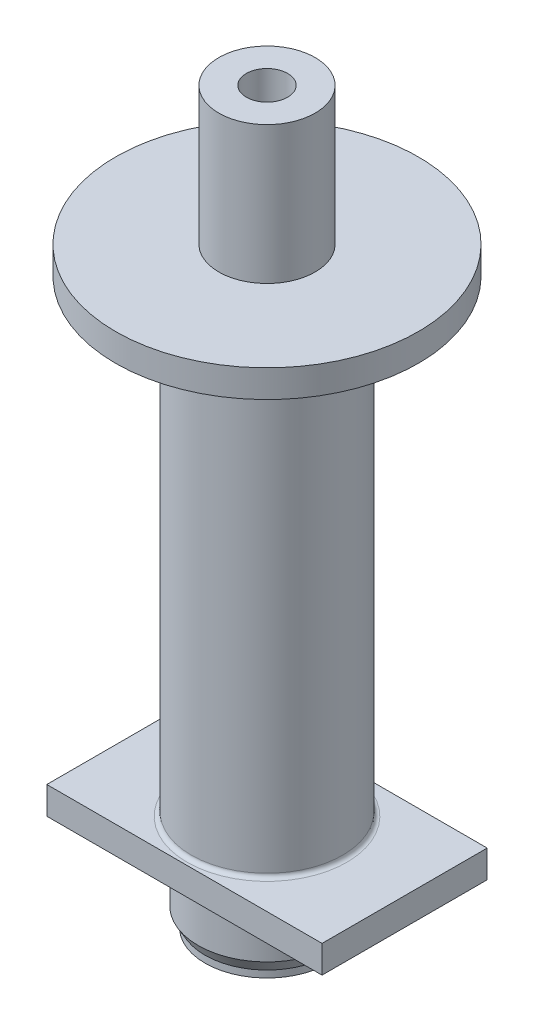
from build123d import *

# Parameters (mm, degrees)
FILLET1_R           = 3
SKETCH3_R           = 25
CUT_EXTRUDE2_DEPTH  = 410
SKETCH4_R           = 15
CUT_EXTRUDE3_DEPTH  = 150
BOSS_EXTRUDE1_DEPTH = 20


with BuildPart() as part:
    # Sketch1 → Revolve1 (revolve)
    with BuildSketch(Plane.XY, mode=Mode.PRIVATE) as revolve1_sk:
        with BuildLine():
            Line((0, 0), (-45, 0))
            Line((-45, 0), (-45, 5))
            Line((-45, 5), (-50, 13.660254038))
            Line((-50, 13.660254038), (-50, 45))
            ThreePointArc((-50, 45), (-51.464466094, 48.535533906), (-55, 50))
            Line((-55, 50), (-60, 50))
            Line((-60, 50), (-60, 70))
            Line((-60, 70), (-55, 70))
            Line((-55, 70), (-55, 410))
            Line((-55, 410), (-110, 410))
            Line((-110, 410), (-110, 430))
            Line((-110, 430), (-35, 430))
            Line((-35, 430), (-35, 530))
            Line((-35, 530), (0, 530))
            Line((0, 530), (0, 0))
        make_face()
    revolve(revolve1_sk.sketch.rotate(Axis((0, 530, 0), (0, -1, 0)), 270), axis=Axis((0, 530, 0), (0, -1, 0)))

    # Fillet1
    fillet1_edges = [part.edges().sort_by_distance(p)[0] for p in [
        (0, 70, -55),
    ]]
    fillet(fillet1_edges, radius=FILLET1_R)

    # Sketch3 → Cut-Extrude2 (cut)
    with BuildSketch(Plane.XZ):
        with Locations(Location((0, 0, 0), (0, 0, 270))):
            Circle(SKETCH3_R)
    extrude(amount=-CUT_EXTRUDE2_DEPTH, mode=Mode.SUBTRACT)

    # Sketch4 → Cut-Extrude3 (cut)
    with BuildSketch(Plane(origin=(0, 530, 0), x_dir=(1, 0, 0), z_dir=(0, 1, 0))):
        with Locations(Location((0, 0, 0), (0, 0, 180))):
            Circle(SKETCH4_R)
    extrude(amount=-CUT_EXTRUDE3_DEPTH, mode=Mode.SUBTRACT)

    # Sketch6 → Boss-Extrude1 (add)
    with BuildSketch(Plane(origin=(0, 50, 0), x_dir=(1, 0, 0), z_dir=(0, 1, 0))):
        Polygon((0, -60), (100, -60), (100, 60), (-100, 60), (-100, -60), align=None)
    extrude(amount=BOSS_EXTRUDE1_DEPTH)


solid = part.part
